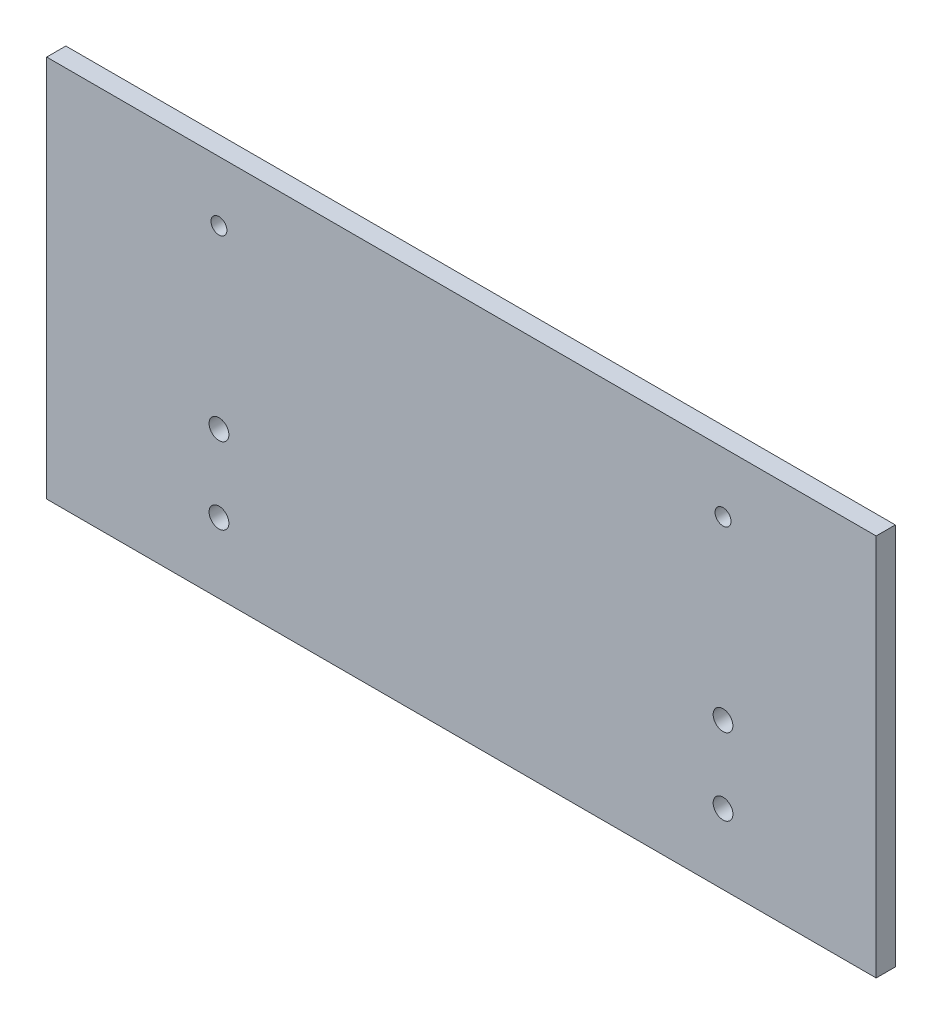
from build123d import *

# Parameters (mm, degrees)
SKETCH1_W           = 130
SKETCH1_H           = 60
SKETCH1_R           = 1.55
SKETCH1_R_2         = 1.25
BOSS_EXTRUDE1_DEPTH = 3


with BuildPart() as part:
    # Sketch1 → Boss-Extrude1 (new body)
    with BuildSketch(Plane.XY):
        with Locations((3.905579399, 21.087982833)):
            Rectangle(SKETCH1_W, SKETCH1_H)
        with Locations((-34.094420601, 14.087982833)):
            Circle(SKETCH1_R, mode=Mode.SUBTRACT)
        with Locations((-34.094420601, 2.087982833)):
            Circle(SKETCH1_R, mode=Mode.SUBTRACT)
        with Locations((44.905579399, 2.087982833)):
            Circle(SKETCH1_R, mode=Mode.SUBTRACT)
        with Locations((44.905579399, 14.087982833)):
            Circle(SKETCH1_R, mode=Mode.SUBTRACT)
        with Locations((-34.094420601, 41.687982833)):
            Circle(SKETCH1_R_2, mode=Mode.SUBTRACT)
        with Locations((44.905579399, 41.687982833)):
            Circle(SKETCH1_R_2, mode=Mode.SUBTRACT)
    extrude(amount=BOSS_EXTRUDE1_DEPTH)


solid = part.part
